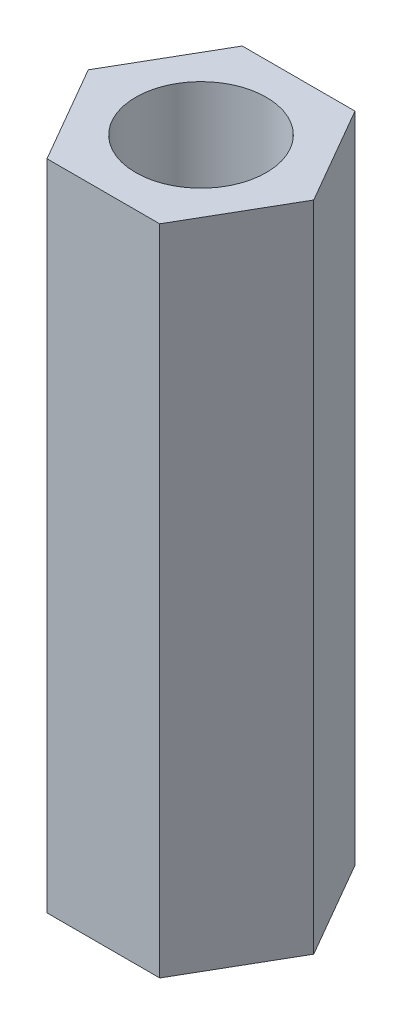
from build123d import *

# Parameters (mm, degrees)
SKETCH1_R           = 1.5
BOSS_EXTRUDE1_DEPTH = 15


with BuildPart() as part:
    # Sketch1 → Boss-Extrude1 (new body)
    with BuildSketch(Plane(origin=(0, 0, 0), x_dir=(1, 0, 0), z_dir=(0, 1, 0))):
        Polygon((-1.294560663, 2.242244841), (-2.589121325, 0), (-1.294560663, -2.242244841), (1.294560663, -2.242244841), (2.589121325, 0), (1.294560663, 2.242244841), align=None)
        with Locations(Location((0, 0, 0), (0, 0, 270))):
            Circle(SKETCH1_R, mode=Mode.SUBTRACT)
    extrude(amount=BOSS_EXTRUDE1_DEPTH)


solid = part.part
